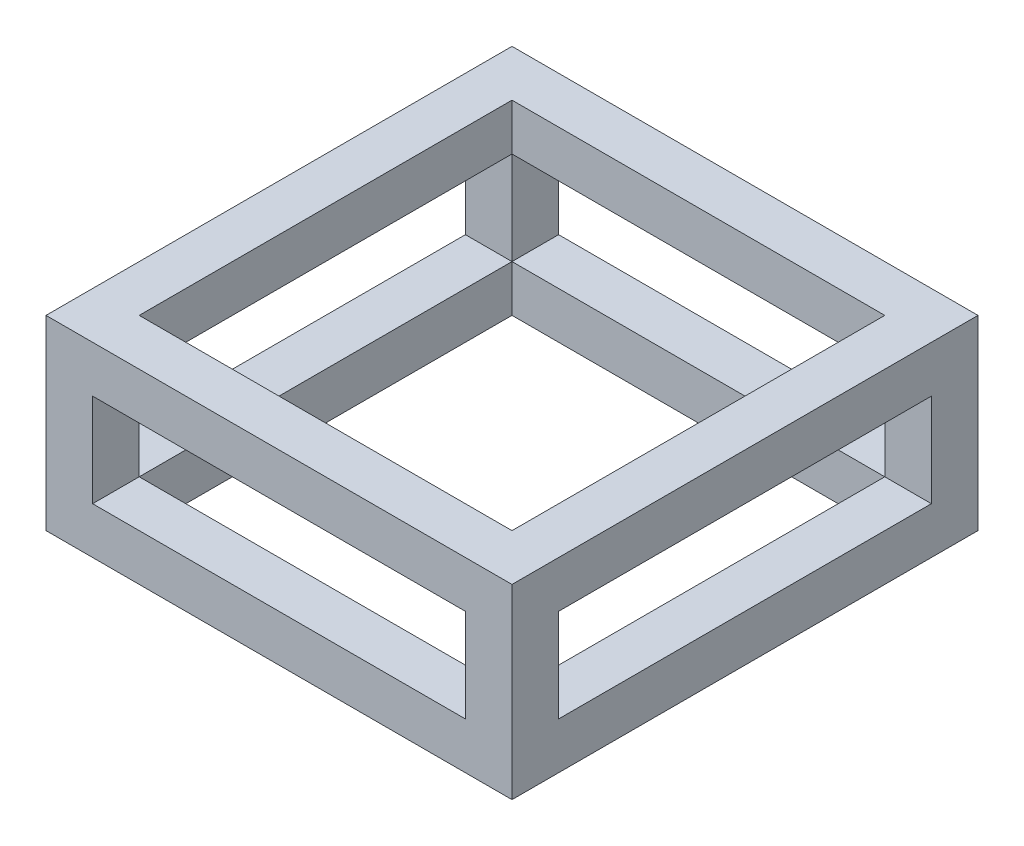
from build123d import *

# Parameters (mm, degrees)
SKETCH1_W           = 150
SKETCH1_H           = 150
SKETCH1_W_2         = 120
SKETCH1_H_2         = 120
BOSS_EXTRUDE1_DEPTH = 15
SKETCH2_W           = 15
SKETCH2_H           = 15
BOSS_EXTRUDE2_DEPTH = 30
SKETCH3_W           = 150
SKETCH3_H           = 150
SKETCH3_W_2         = 120
SKETCH3_H_2         = 120
BOSS_EXTRUDE3_DEPTH = 15


with BuildPart() as part:
    # Sketch1 → Boss-Extrude1 (new body)
    with BuildSketch(Plane(origin=(0, 0, 0), x_dir=(1, 0, 0), z_dir=(0, 1, 0))):
        Rectangle(SKETCH1_W, SKETCH1_H)
        Rectangle(SKETCH1_W_2, SKETCH1_H_2, mode=Mode.SUBTRACT)
    extrude(amount=BOSS_EXTRUDE1_DEPTH)

    # Sketch2 → Boss-Extrude2 (add)
    with BuildSketch(Plane(origin=(0, 15, 0), x_dir=(1, 0, 0), z_dir=(0, 1, 0))):
        with Locations((-67.5, 67.5)):
            Rectangle(SKETCH2_W, SKETCH2_H)
        with Locations((67.5, 67.5)):
            Rectangle(SKETCH2_W, SKETCH2_H)
        with Locations((67.5, -67.5)):
            Rectangle(SKETCH2_W, SKETCH2_H)
        with Locations((-67.5, -67.5)):
            Rectangle(SKETCH2_W, SKETCH2_H)
    extrude(amount=BOSS_EXTRUDE2_DEPTH)

    # Sketch3 → Boss-Extrude3 (add)
    with BuildSketch(Plane(origin=(0, 45, 0), x_dir=(1, 0, 0), z_dir=(0, 1, 0))):
        Rectangle(SKETCH3_W, SKETCH3_H)
        Rectangle(SKETCH3_W_2, SKETCH3_H_2, mode=Mode.SUBTRACT)
    extrude(amount=BOSS_EXTRUDE3_DEPTH)


solid = part.part
